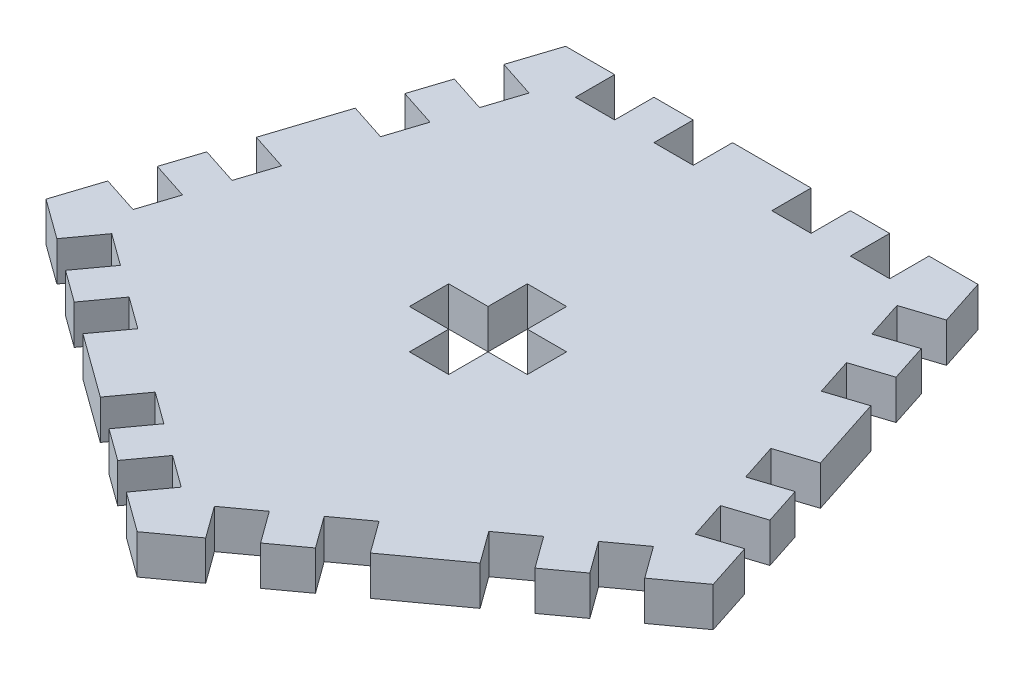
from build123d import *

# Parameters (mm, degrees)
BOSS_EXTRUDE1_DEPTH = 5.08
SKETCH2_W           = 5.08
SKETCH2_H           = 5.08
CUT_EXTRUDE1_DEPTH  = 5.08
CUT_EXTRUDE2_DEPTH  = 5.08


with BuildPart() as part:
    # Sketch1 → Boss-Extrude1 (new body)
    with BuildSketch(Plane(origin=(0, 0, 0), x_dir=(1, 0, 0), z_dir=(0, 1, 0))):
        Polygon((0, -45.356701101), (43.13678614, -14.015991449), (26.66, 36.694342), (-26.66, 36.694342), (-43.13678614, -14.015991449), align=None)
    extrude(amount=BOSS_EXTRUDE1_DEPTH)

    # Sketch2 → Cut-Extrude1 (cut)
    with BuildSketch(Plane(origin=(0, 5.08, 0), x_dir=(1, 0, 0), z_dir=(0, 1, 0))):
        with Locations((-17.78, 34.154342)):
            Rectangle(SKETCH2_W, SKETCH2_H)
        with Locations((7.62, 34.154342)):
            Rectangle(SKETCH2_W, SKETCH2_H)
        with Locations((17.78, 34.154342)):
            Rectangle(SKETCH2_W, SKETCH2_H)
        with Locations((-7.62, 34.154342)):
            Rectangle(SKETCH2_W, SKETCH2_H)
        Polygon((28.619167744, 30.664643686), (23.787800642, 29.094837355), (25.357606973, 24.263470252), (30.188974076, 25.833276584), align=None)
        Polygon((36.468199401, 6.507808173), (38.038005733, 1.67644107), (33.20663863, 0.106634738), (31.636832299, 4.938001841), align=None)
        Polygon((39.607812064, -3.154926033), (41.177618396, -7.986293136), (36.346251293, -9.556099467), (34.776444962, -4.724732364), align=None)
        Polygon((31.758780407, 21.001909481), (26.927413304, 19.432103149), (28.497219636, 14.600736047), (33.328586739, 16.170542378), align=None)
        Polygon((38.007618396, -17.742549949), (35.021669314, -13.632743617), (30.911862983, -16.618692699), (33.897812064, -20.72849903), align=None)
        Polygon((17.458586739, -32.672295357), (13.348780407, -35.658244439), (10.362831326, -31.548438107), (14.472637657, -28.562489025), align=None)
        Polygon((9.238974076, -38.64419352), (5.129167744, -41.630142602), (2.143218663, -37.52033627), (6.253024994, -34.534387189), align=None)
        Polygon((29.788005733, -23.714448112), (26.802056651, -19.60464178), (22.69225032, -22.590590862), (25.678199401, -26.700397194), align=None)
        Polygon((-5.129167744, -41.630142602), (-2.143218663, -37.52033627), (-6.253024994, -34.534387189), (-9.238974076, -38.64419352), align=None)
        Polygon((-25.678199401, -26.700397194), (-29.788005733, -23.714448112), (-26.802056651, -19.60464178), (-22.69225032, -22.590590862), align=None)
        Polygon((-33.897812064, -20.72849903), (-38.007618396, -17.742549949), (-35.021669314, -13.632743617), (-30.911862983, -16.618692699), align=None)
        Polygon((-13.348780407, -35.658244439), (-10.362831326, -31.548438107), (-14.472637657, -28.562489025), (-17.458586739, -32.672295357), align=None)
        Polygon((-41.177618396, -7.986293136), (-36.346251293, -9.556099467), (-34.776444962, -4.724732364), (-39.607812064, -3.154926033), align=None)
        Polygon((-33.328586739, 16.170542378), (-31.758780407, 21.001909481), (-26.927413304, 19.432103149), (-28.497219636, 14.600736047), align=None)
        Polygon((-30.188974076, 25.833276584), (-28.619167744, 30.664643686), (-23.787800642, 29.094837355), (-25.357606973, 24.263470252), align=None)
        Polygon((-38.038005733, 1.67644107), (-33.20663863, 0.106634738), (-31.636832299, 4.938001841), (-36.468199401, 6.507808173), align=None)
    extrude(amount=-CUT_EXTRUDE1_DEPTH, mode=Mode.SUBTRACT)

    # Sketch3 → Cut-Extrude2 (cut)
    with BuildSketch(Plane(origin=(0, 5.08, 0), x_dir=(1, 0, 0), z_dir=(0, 1, 0))):
        Polygon((0, 7.62), (2.54, 7.62), (2.54, 2.54), (7.62, 2.54), (7.62, 0), (7.62, -2.54), (2.54, -2.54), (2.54, -7.62), (0, -7.62), (-2.54, -7.62), (-2.54, -2.54), (-7.62, -2.54), (-7.62, 0), (-7.62, 2.54), (-2.54, 2.54), (-2.54, 7.62), align=None)
    extrude(amount=-CUT_EXTRUDE2_DEPTH, mode=Mode.SUBTRACT)


solid = part.part
